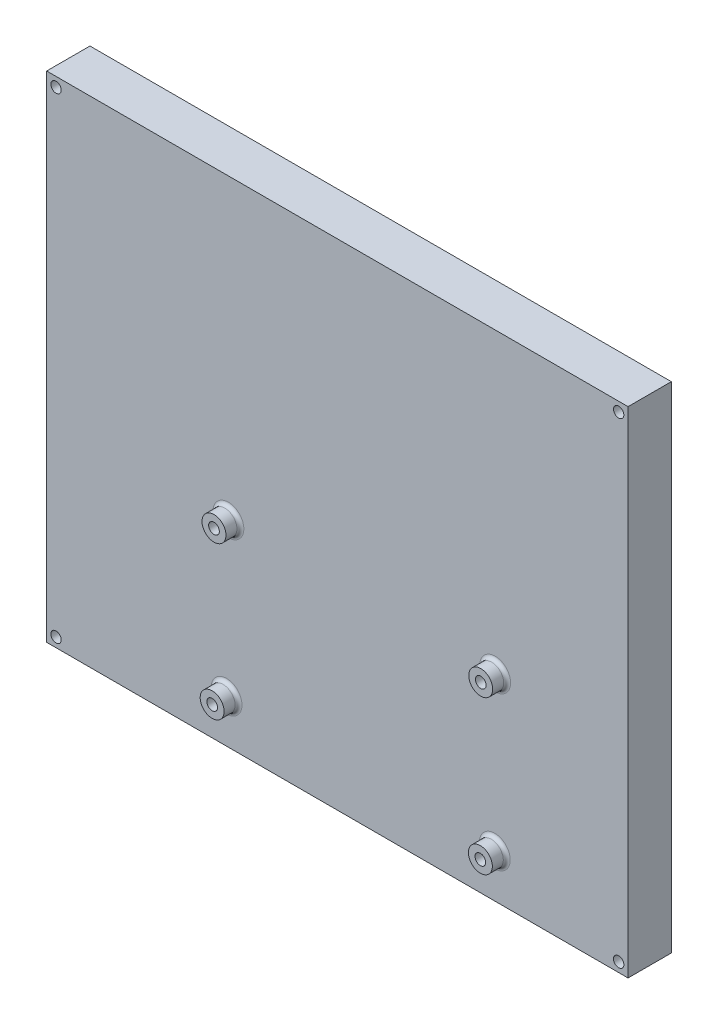
from build123d import *

# Parameters (mm, degrees)
SKETCH1_W             = 201.5
SKETCH1_H             = 171.5
MAIN_BODY_DEPTH       = 15
SKETCH2_R             = 1.8
SCREW_HOLES_DEPTH     = 15
SKETCH3_R             = 4.15
SKETCH3_R_2           = 1.85
PCB_SCREW_AREA_DEPTH  = 5
SKETCH4_W             = 180
SKETCH4_H             = 150
MAIN_CUT_DEPTH        = 12
FILLET3_R             = 1.2
PCB_START             = -2
SKETCH6_R             = 1.85
PCB_SCREW_HOLES_DEPTH = 2


with BuildPart() as part:
    # Sketch1 → Main Body (new body)
    with BuildSketch(Plane.XY):
        Rectangle(SKETCH1_W, SKETCH1_H)
    extrude(amount=MAIN_BODY_DEPTH)

    # Sketch2 → Screw Holes (cut)
    with BuildSketch(Plane.XY.offset(15)):
        with Locations((-97.5, 82.5)):
            Circle(SKETCH2_R)
        with Locations((97.5, 82.5)):
            Circle(SKETCH2_R)
        with Locations((97.5, -82.5)):
            Circle(SKETCH2_R)
        with Locations((-97.5, -82.5)):
            Circle(SKETCH2_R)
    extrude(amount=-SCREW_HOLES_DEPTH, mode=Mode.SUBTRACT)

    # Sketch3 → PCB Screw Area (add)
    # profile 1 of 4: a face of its own
    with BuildSketch(Plane.XY.offset(15)):
        with Locations((-37.7639992, -17.5345021)):
            Circle(SKETCH3_R)
        with Locations((-37.7639992, -17.5345021)):
            Circle(SKETCH3_R_2, mode=Mode.SUBTRACT)
    # profile 2 of 4: a face of its own
    with BuildSketch(Plane.XY.offset(15)):
        with Locations((54.6920008, -17.5345021)):
            Circle(SKETCH3_R)
        with Locations((54.6920008, -17.5345021)):
            Circle(SKETCH3_R_2, mode=Mode.SUBTRACT)
    # profile 3 of 4: a face of its own
    with BuildSketch(Plane.XY.offset(15)):
        with Locations((54.5650008, -70.7475021)):
            Circle(SKETCH3_R)
        with Locations((54.5650008, -70.7475021)):
            Circle(SKETCH3_R_2, mode=Mode.SUBTRACT)
    # profile 4 of 4: a face of its own
    with BuildSketch(Plane.XY.offset(15)):
        with Locations((-38.3989992, -70.7475021)):
            Circle(SKETCH3_R)
        with Locations((-38.3989992, -70.7475021)):
            Circle(SKETCH3_R_2, mode=Mode.SUBTRACT)
    extrude(amount=PCB_SCREW_AREA_DEPTH)

    # Sketch4 → Main Cut (cut)
    with BuildSketch(Plane(origin=(0, 0, 0), x_dir=(-1, 0, 0), z_dir=(0, 0, -1))):
        Rectangle(SKETCH4_W, SKETCH4_H)
    extrude(amount=-MAIN_CUT_DEPTH, mode=Mode.SUBTRACT)

    # Fillet3
    fillet3_edges = [part.edges().sort_by_distance(p)[0] for p in [
        (-42.5489992, -70.7475021, 15),
        (50.4150008, -70.7475021, 15),
        (50.5420008, -17.5345021, 15),
        (-41.9139992, -17.5345021, 15),
    ]]
    fillet(fillet3_edges, radius=FILLET3_R)

    # Sketch6 → PCB Screw Holes (cut)
    with BuildSketch(Plane.XY.offset(15).offset(PCB_START)):
        with Locations((-37.7639992, -17.5345021)):
            Circle(SKETCH6_R)
        with Locations((-38.3989992, -70.7475021)):
            Circle(SKETCH6_R)
        with Locations((54.5650008, -70.7475021)):
            Circle(SKETCH6_R)
        with Locations((54.6920008, -17.5345021)):
            Circle(SKETCH6_R)
    extrude(amount=PCB_SCREW_HOLES_DEPTH, mode=Mode.SUBTRACT)


solid = part.part
